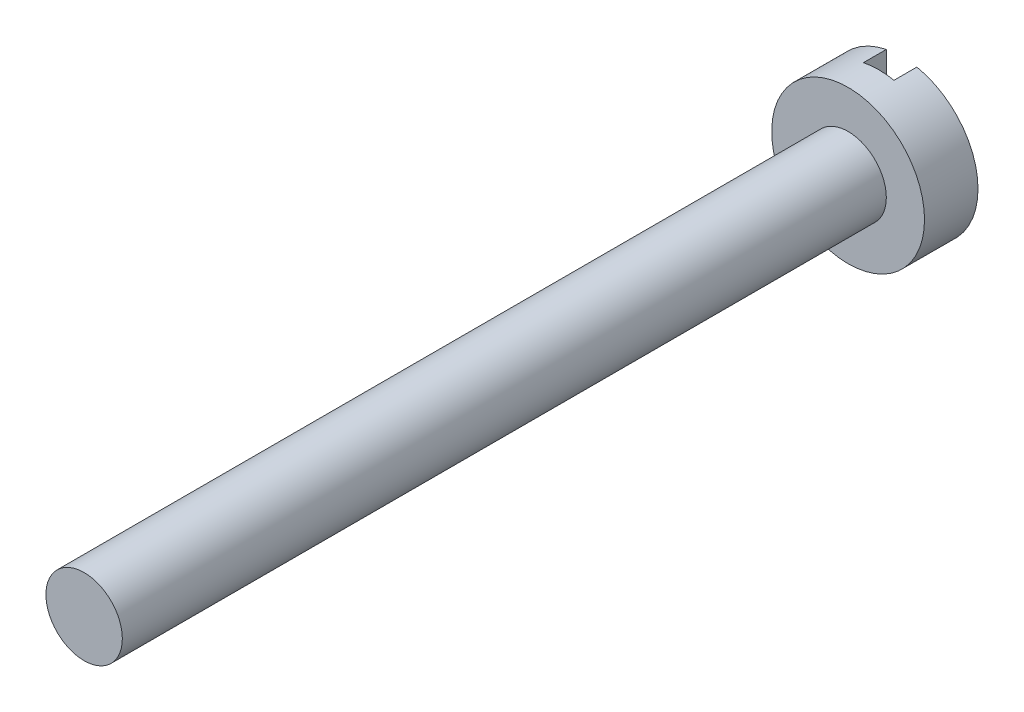
from build123d import *

# Parameters (mm, degrees)
SKETCH1_R           = 1
BOSS_EXTRUDE1_DEPTH = 0.7
SKETCH3_R           = 0.5
BOSS_EXTRUDE2_DEPTH = 10
SKETCH5_W           = 0.4
SKETCH5_H           = 2
CUT_EXTRUDE1_DEPTH  = 0.3


with BuildPart() as part:
    # Sketch1 → Boss-Extrude1 (new body)
    with BuildSketch(Plane.XY):
        Circle(SKETCH1_R)
    extrude(amount=BOSS_EXTRUDE1_DEPTH)

    # Sketch3 → Boss-Extrude2 (add)
    with BuildSketch(Plane.XY.offset(0.7)):
        Circle(SKETCH3_R)
    extrude(amount=BOSS_EXTRUDE2_DEPTH)

    # Sketch5 → Cut-Extrude1 (cut)
    with BuildSketch(Plane(origin=(0, 0, 0), x_dir=(-1, 0, 0), z_dir=(0, 0, -1))):
        Rectangle(SKETCH5_W, SKETCH5_H)
    extrude(amount=-CUT_EXTRUDE1_DEPTH, mode=Mode.SUBTRACT)


solid = part.part
